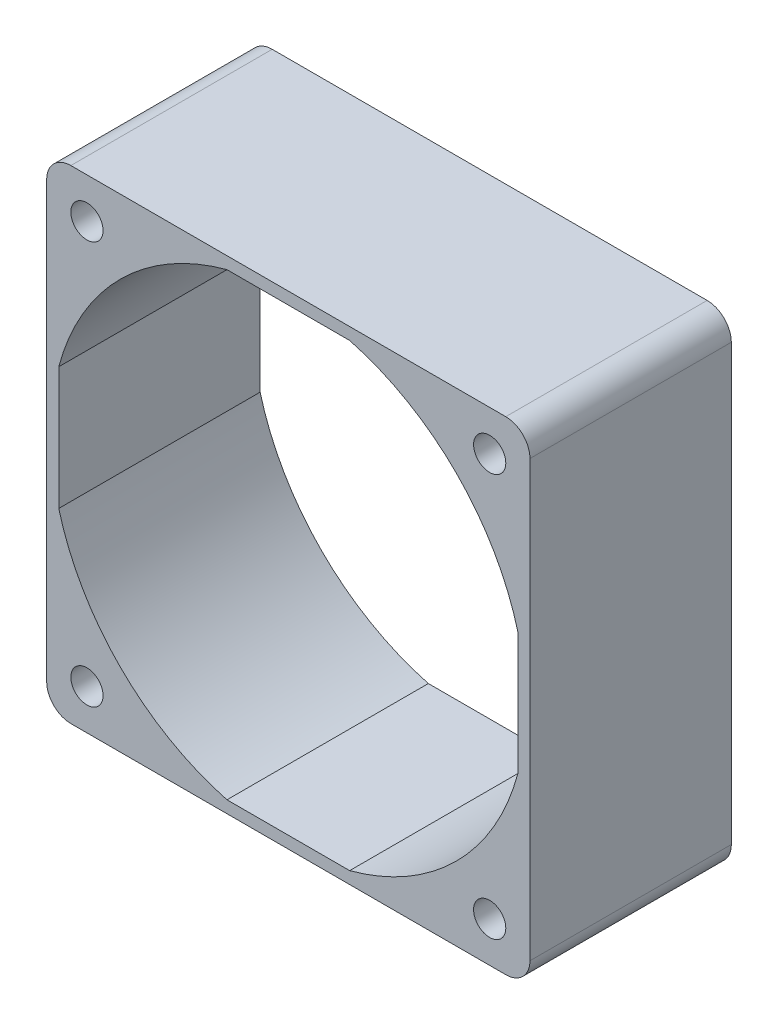
from build123d import *

# Parameters (mm, degrees)
SKETCH1_R           = 2
BOSS_EXTRUDE1_DEPTH = 25


with BuildPart() as part:
    # Sketch1 → Boss-Extrude1 (new body)
    with BuildSketch(Plane.XY):
        with BuildLine():
            Line((-27, 30), (27, 30))
            ThreePointArc((27, 30), (29.121320344, 29.121320344), (30, 27))
            Line((30, 27), (30, -27))
            ThreePointArc((30, -27), (29.121320344, -29.121320344), (27, -30))
            Line((27, -30), (-27, -30))
            ThreePointArc((-27, -30), (-29.121320344, -29.121320344), (-30, -27))
            Line((-30, -27), (-30, 27))
            ThreePointArc((-30, 27), (-29.121320344, 29.121320344), (-27, 30))
        make_face()
        with Locations((-25, 25)):
            Circle(SKETCH1_R, mode=Mode.SUBTRACT)
        with Locations((25, 25)):
            Circle(SKETCH1_R, mode=Mode.SUBTRACT)
        with Locations((25, -25)):
            Circle(SKETCH1_R, mode=Mode.SUBTRACT)
        with Locations((-25, -25)):
            Circle(SKETCH1_R, mode=Mode.SUBTRACT)
        with BuildLine():
            Line((-7.615773106, 28.5), (7.615773106, 28.5))
            ThreePointArc((7.615773106, 28.5), (20.859650045, 20.859650045), (28.5, 7.615773106))
            Line((28.5, 7.615773106), (28.5, -7.615773106))
            ThreePointArc((28.5, -7.615773106), (20.859650045, -20.859650045), (7.615773106, -28.5))
            Line((7.615773106, -28.5), (-7.615773106, -28.5))
            ThreePointArc((-7.615773106, -28.5), (-20.859650045, -20.859650045), (-28.5, -7.615773106))
            Line((-28.5, -7.615773106), (-28.5, 7.615773106))
            ThreePointArc((-28.5, 7.615773106), (-20.859650045, 20.859650045), (-7.615773106, 28.5))
        make_face(mode=Mode.SUBTRACT)
    extrude(amount=BOSS_EXTRUDE1_DEPTH)


solid = part.part
